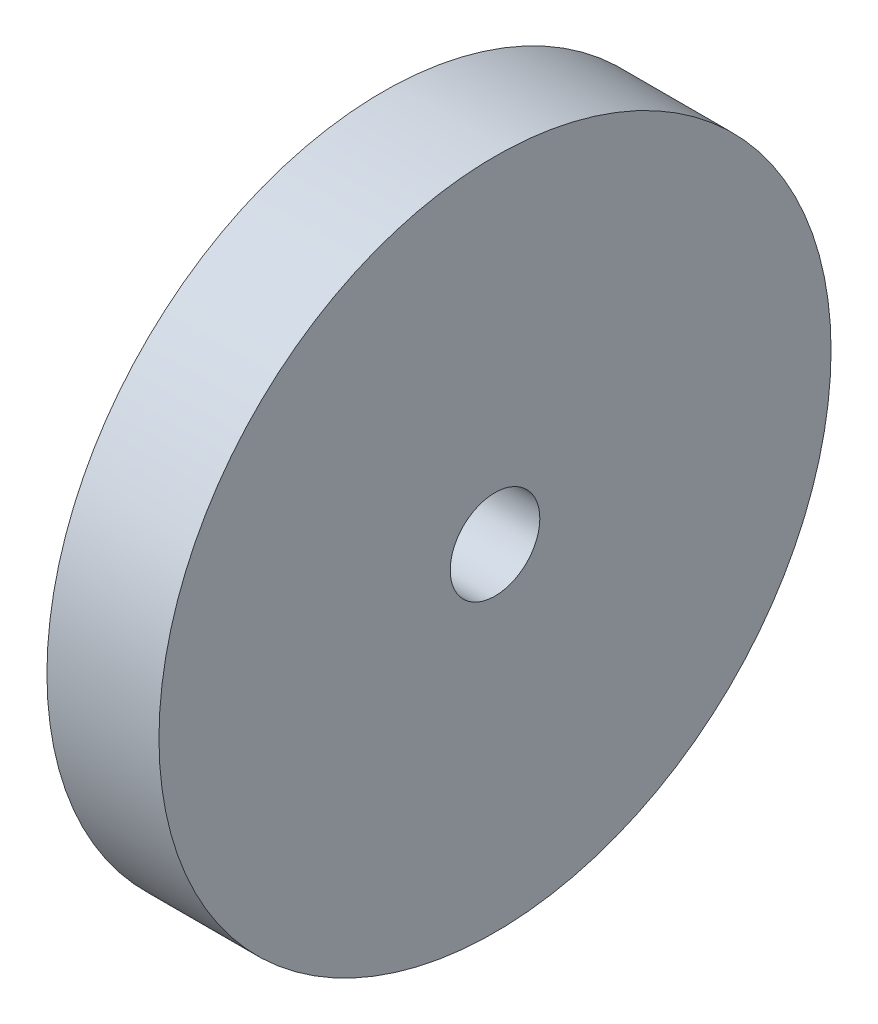
from build123d import *

# Parameters (mm, degrees)
CROQUIS1_R              = 15
CROQUIS1_R_2            = 2
SALIENTE_EXTRUIR1_DEPTH = 5


with BuildPart() as part:
    # Croquis1 → Saliente-Extruir1 (new body)
    with BuildSketch(Plane(origin=(0, 0, 0), x_dir=(0, 0, -1), z_dir=(1, 0, 0))):
        Circle(CROQUIS1_R)
        Circle(CROQUIS1_R_2, mode=Mode.SUBTRACT)
    extrude(amount=SALIENTE_EXTRUIR1_DEPTH)


solid = part.part
